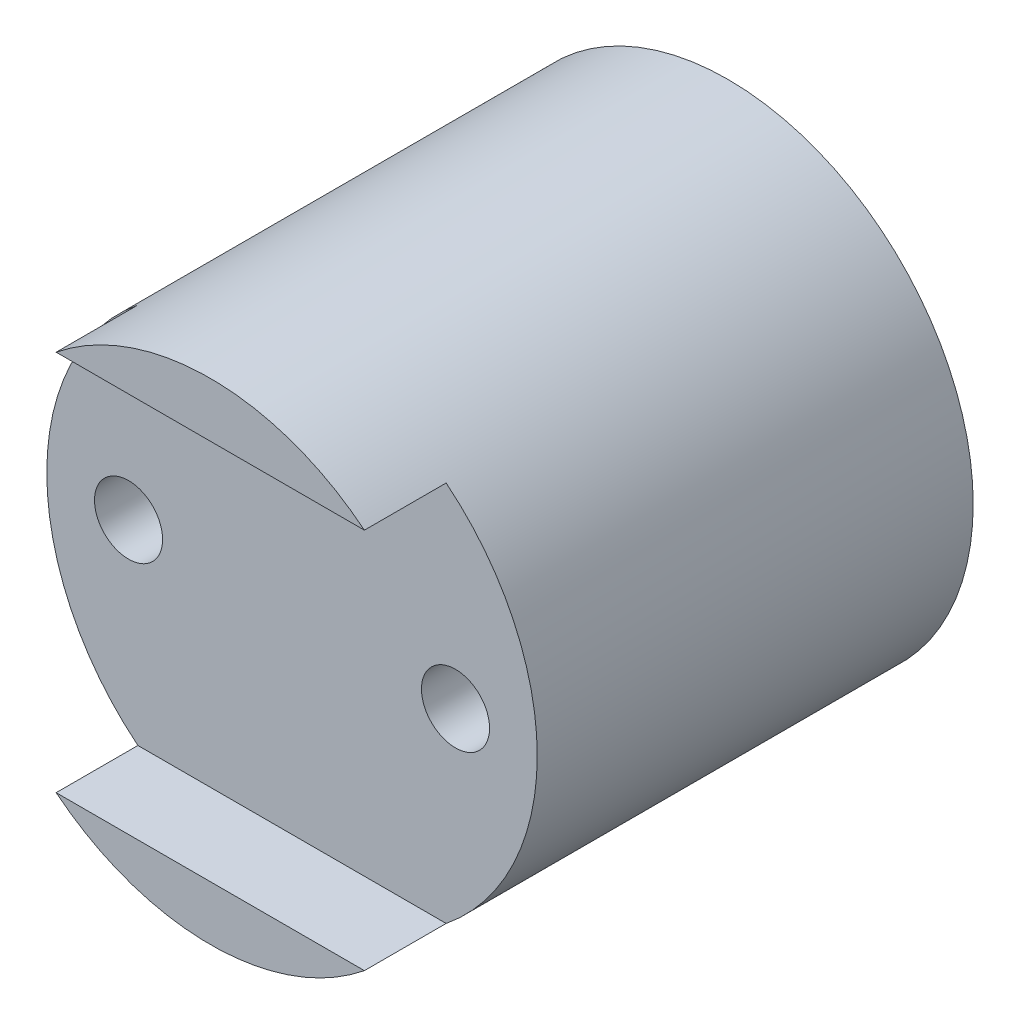
from build123d import *

# Parameters (mm, degrees)
SKETCH1_R           = 9
BODY_DEPTH          = 19
SKETCH2_R           = 4
BORE_DEPTH          = 12
SKETCH3_W           = 1.5
SKETCH3_H           = 9
BORE_FLAT_DEPTH     = 12
SKETCH4_R           = 3
MAGNET_POCKET_DEPTH = 3
SKETCH5_W           = 22
SKETCH5_H           = 14
ARM_SLOT_DEPTH      = 3
SKETCH6_R           = 1.25
ARM_SCREWS_DEPTH    = 6


with BuildPart() as part:
    # Sketch1 → Body (new body)
    with BuildSketch(Plane.XY):
        Circle(SKETCH1_R)
    extrude(amount=BODY_DEPTH)

    # Sketch2 → Bore (cut)
    with BuildSketch(Plane.XY):
        Circle(SKETCH2_R)
    extrude(amount=BORE_DEPTH, mode=Mode.SUBTRACT)

    # Sketch3 → Bore_flat (add)
    with BuildSketch(Plane.XY):
        with Locations((3.95, 0)):
            Rectangle(SKETCH3_W, SKETCH3_H)
    extrude(amount=BORE_FLAT_DEPTH)

    # Sketch4 → Magnet_pocket (cut)
    with BuildSketch(Plane.XY.offset(12)):
        Circle(SKETCH4_R)
    extrude(amount=MAGNET_POCKET_DEPTH, mode=Mode.SUBTRACT)

    # Sketch5 → Arm_slot (cut)
    with BuildSketch(Plane.XY.offset(16)):
        Rectangle(SKETCH5_W, SKETCH5_H)
    extrude(amount=ARM_SLOT_DEPTH, mode=Mode.SUBTRACT)

    # Sketch6 → Arm_screws (cut)
    with BuildSketch(Plane.XY.offset(10)):
        with Locations((-6, 0)):
            Circle(SKETCH6_R)
        with Locations((6, 0)):
            Circle(SKETCH6_R)
    extrude(amount=ARM_SCREWS_DEPTH, mode=Mode.SUBTRACT)


solid = part.part
